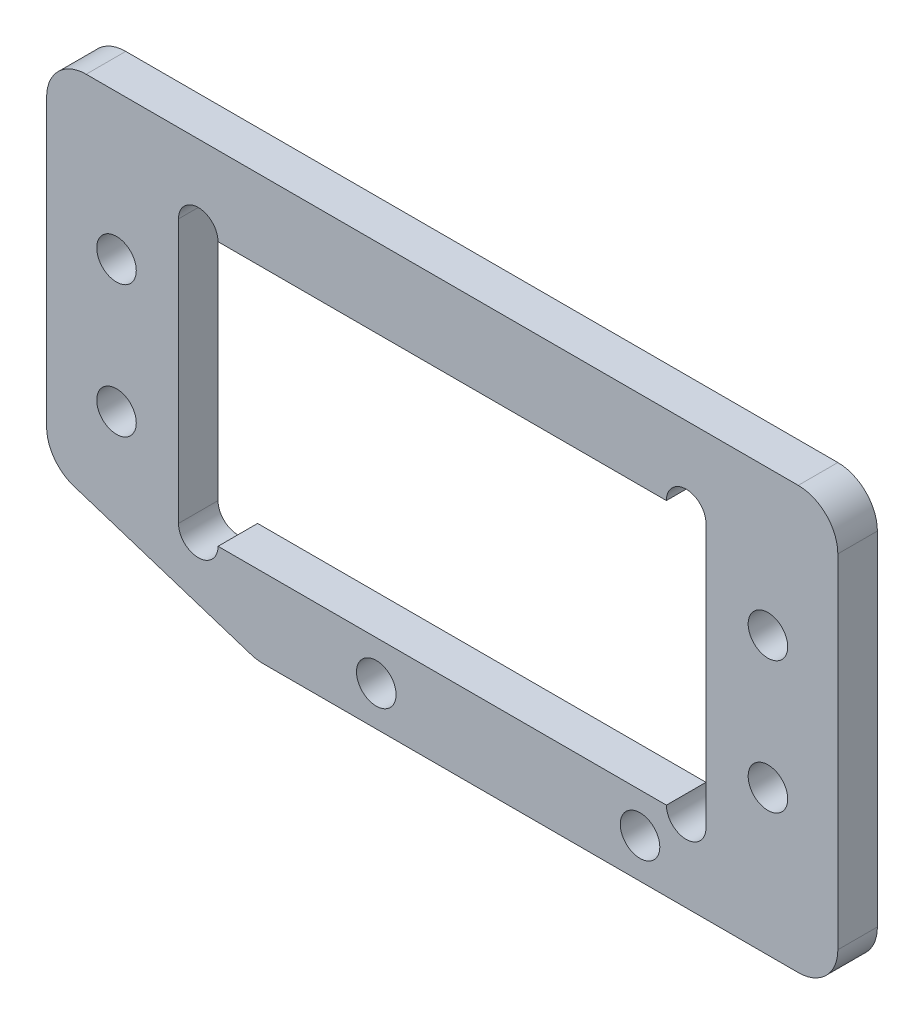
from build123d import *

# Parameters (mm, degrees)
SKETCH_1_W          = 60
SKETCH_1_H          = 32
SKETCH_1_R          = 1.5
SKETCH_1_W_2        = 40
SKETCH_1_H_2        = 20
EXTRUDE_1_DEPTH     = 3
SKETCH_2_R          = 1.5
CUT_EXTRUDE_1_DEPTH = 3
FILLET_1_R          = 3
CUT_EXTRUDE_2_DEPTH = 10
FILLET_2_R          = 3


with BuildPart() as part:
    # 草图1 → 凸台-拉伸1 (new body)
    with BuildSketch(Plane.XY):
        with Locations((20, -10)):
            Rectangle(SKETCH_1_W, SKETCH_1_H)
        with Locations((-4.7, -5)):
            Circle(SKETCH_1_R, mode=Mode.SUBTRACT)
        with Locations((-4.7, -15)):
            Circle(SKETCH_1_R, mode=Mode.SUBTRACT)
        with Locations((44.7, -5)):
            Circle(SKETCH_1_R, mode=Mode.SUBTRACT)
        with Locations((44.7, -15)):
            Circle(SKETCH_1_R, mode=Mode.SUBTRACT)
        with Locations((35, -23)):
            Circle(SKETCH_1_R, mode=Mode.SUBTRACT)
        with Locations((15, -23)):
            Circle(SKETCH_1_R, mode=Mode.SUBTRACT)
        with Locations((20, -10)):
            Rectangle(SKETCH_1_W_2, SKETCH_1_H_2, mode=Mode.SUBTRACT)
    extrude(amount=EXTRUDE_1_DEPTH)

    # 草图2 → 切除-拉伸1 (cut)
    with BuildSketch(Plane.XY.offset(3)):
        with Locations((1.5, 0)):
            Circle(SKETCH_2_R)
        with Locations((38.5, 0)):
            Circle(SKETCH_2_R)
        with Locations((38.5, -20)):
            Circle(SKETCH_2_R)
        with Locations((1.5, -20)):
            Circle(SKETCH_2_R)
    extrude(amount=-CUT_EXTRUDE_1_DEPTH, mode=Mode.SUBTRACT)

    # 圆角1
    fillet_1_edges = [part.edges().sort_by_distance(p)[0] for p in [
        (-10, 6, 1.5),
        (50, 6, 1.5),
        (50, -26, 1.5),
        (-10, -26, 1.5),
    ]]
    fillet(fillet_1_edges, radius=FILLET_1_R)

    # 草图3 → 切除-拉伸2 (cut)
    with BuildSketch(Plane(origin=(0, 0, 0), x_dir=(-1, 0, 0), z_dir=(0, 0, -1))):
        Polygon((-5.9461814, -26), (10, -20.853371157), (15.489211813, -37.273669186), align=None)
    extrude(amount=-CUT_EXTRUDE_2_DEPTH, mode=Mode.SUBTRACT)

    # 圆角2
    fillet_2_edges = [part.edges().sort_by_distance(p)[0] for p in [
        (5.9461814, -26, 1.5),
        (-10, -20.853371157, 1.5),
    ]]
    fillet(fillet_2_edges, radius=FILLET_2_R)


solid = part.part
